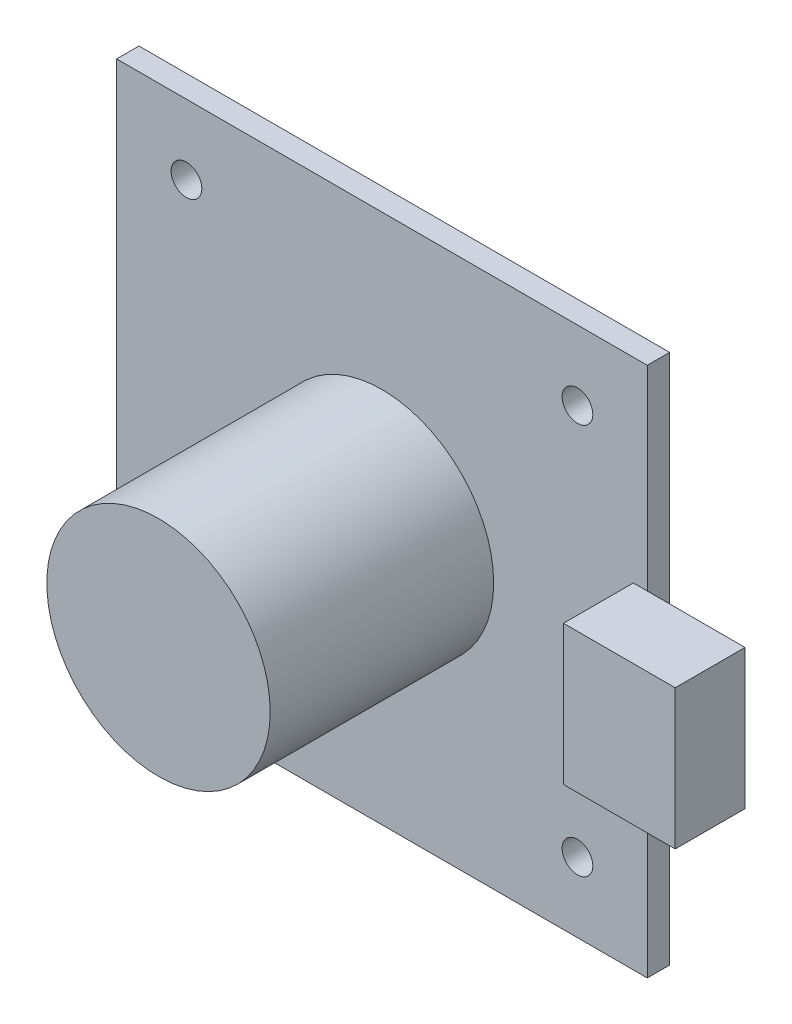
from build123d import *

# Parameters (mm, degrees)
SKETCH_1_W        = 38
SKETCH_1_H        = 38
SKETCH_1_R        = 1.1
USB_38_PCB_DEPTH  = 1.6
EXTRUDE_START     = 1.6
SKETCH_2_R        = 8
EXTRUDE_M12_DEPTH = 16
USB_START         = 1.6
SKETCH_3_W        = 8
SKETCH_3_H        = 10
USB_DEPTH         = 5


with BuildPart() as part:
    # 草图1 → USB摄像头38方PCB占位 (new body)
    with BuildSketch(Plane.XY):
        Rectangle(SKETCH_1_W, SKETCH_1_H)
        with Locations((-14, -14)):
            Circle(SKETCH_1_R, mode=Mode.SUBTRACT)
        with Locations((-14, 14)):
            Circle(SKETCH_1_R, mode=Mode.SUBTRACT)
        with Locations((14, -14)):
            Circle(SKETCH_1_R, mode=Mode.SUBTRACT)
        with Locations((14, 14)):
            Circle(SKETCH_1_R, mode=Mode.SUBTRACT)
    extrude(amount=USB_38_PCB_DEPTH)

    # 草图2 → M12镜头占位 (add)
    with BuildSketch(Plane.XY.offset(EXTRUDE_START)):
        Circle(SKETCH_2_R)
    extrude(amount=EXTRUDE_M12_DEPTH)

    # 草图3 → USB插头接口占位 (add)
    with BuildSketch(Plane.XY.offset(USB_START)):
        with Locations((22, 0)):
            Rectangle(SKETCH_3_W, SKETCH_3_H)
    extrude(amount=USB_DEPTH)


solid = part.part
